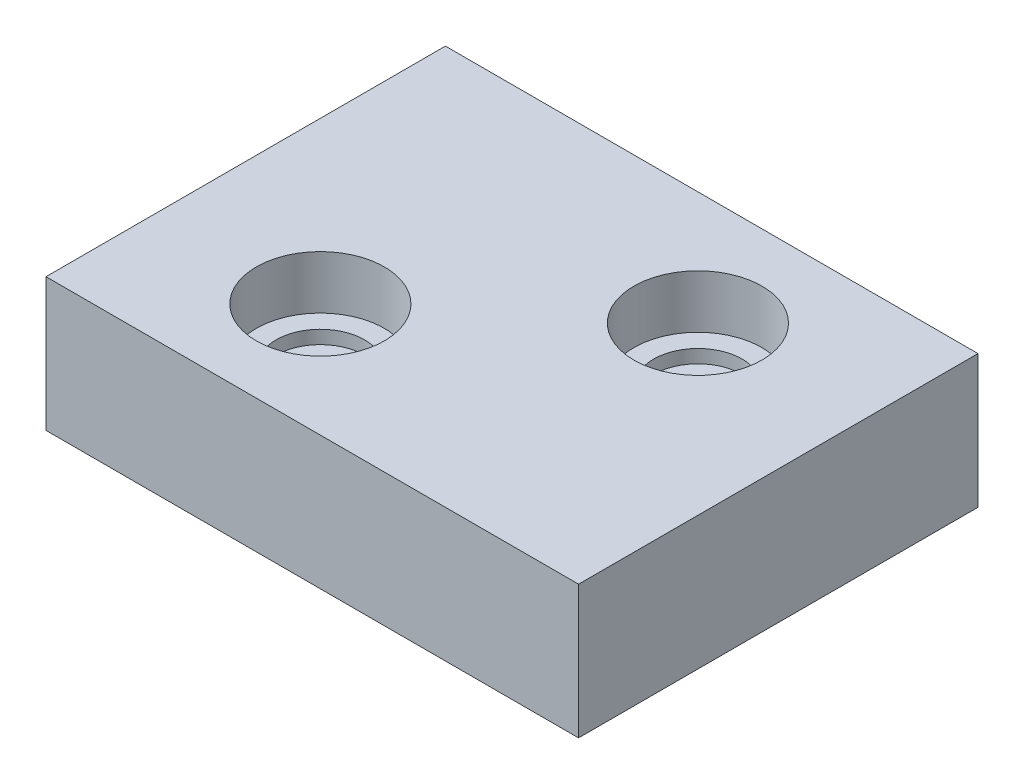
from build123d import *

# Parameters (mm, degrees)
SKETCH1_W           = 40
SKETCH1_H           = 30
BOSS_EXTRUDE1_DEPTH = 10
SKETCH2_R           = 1.55
CUT_EXTRUDE1_DEPTH  = 4
SKETCH3_R           = 4.8125
CUT_EXTRUDE2_DEPTH  = 4
SKETCH4_R           = 3.325
CUT_EXTRUDE3_DEPTH  = 1


with BuildPart() as part:
    # Sketch1 → Boss-Extrude1 (new body)
    with BuildSketch(Plane(origin=(0, 0, 0), x_dir=(1, 0, 0), z_dir=(0, 1, 0))):
        Rectangle(SKETCH1_W, SKETCH1_H)
    extrude(amount=BOSS_EXTRUDE1_DEPTH)

    # Sketch2 → Cut-Extrude1 (cut)
    with BuildSketch(Plane(origin=(0, 0, 0), x_dir=(-1, 0, 0), z_dir=(0, -1, 0))):
        with Locations(Location((-13.333333333, -10, 0), (0, 0, 90))):
            Circle(SKETCH2_R)
        with Locations(Location((13.333333333, -10, 0), (0, 0, 270))):
            Circle(SKETCH2_R)
        with Locations(Location((-13.333333333, 10, 0), (0, 0, 270))):
            Circle(SKETCH2_R)
        with Locations(Location((13.333333333, 10, 0), (0, 0, 90))):
            Circle(SKETCH2_R)
    extrude(amount=-CUT_EXTRUDE1_DEPTH, mode=Mode.SUBTRACT)

    # Sketch3 → Cut-Extrude2 (cut)
    with BuildSketch(Plane(origin=(0, 10, 0), x_dir=(1, 0, 0), z_dir=(0, 1, 0))):
        with Locations(Location((-7.9286, -6.465, 0), (0, 0, 270))):
            Circle(SKETCH3_R)
        with Locations(Location((7.5, 6.4636, 0), (0, 0, 270))):
            Circle(SKETCH3_R)
    extrude(amount=-CUT_EXTRUDE2_DEPTH, mode=Mode.SUBTRACT)

    # Sketch4 → Cut-Extrude3 (cut)
    with BuildSketch(Plane(origin=(0, 6, 0), x_dir=(1, 0, 0), z_dir=(0, 1, 0))):
        with Locations(Location((-7.9286, -6.465, 0), (0, 0, 270))):
            Circle(SKETCH4_R)
        with Locations(Location((7.5, 6.4636, 0), (0, 0, 270))):
            Circle(SKETCH4_R)
    extrude(amount=-CUT_EXTRUDE3_DEPTH, mode=Mode.SUBTRACT)


solid = part.part
